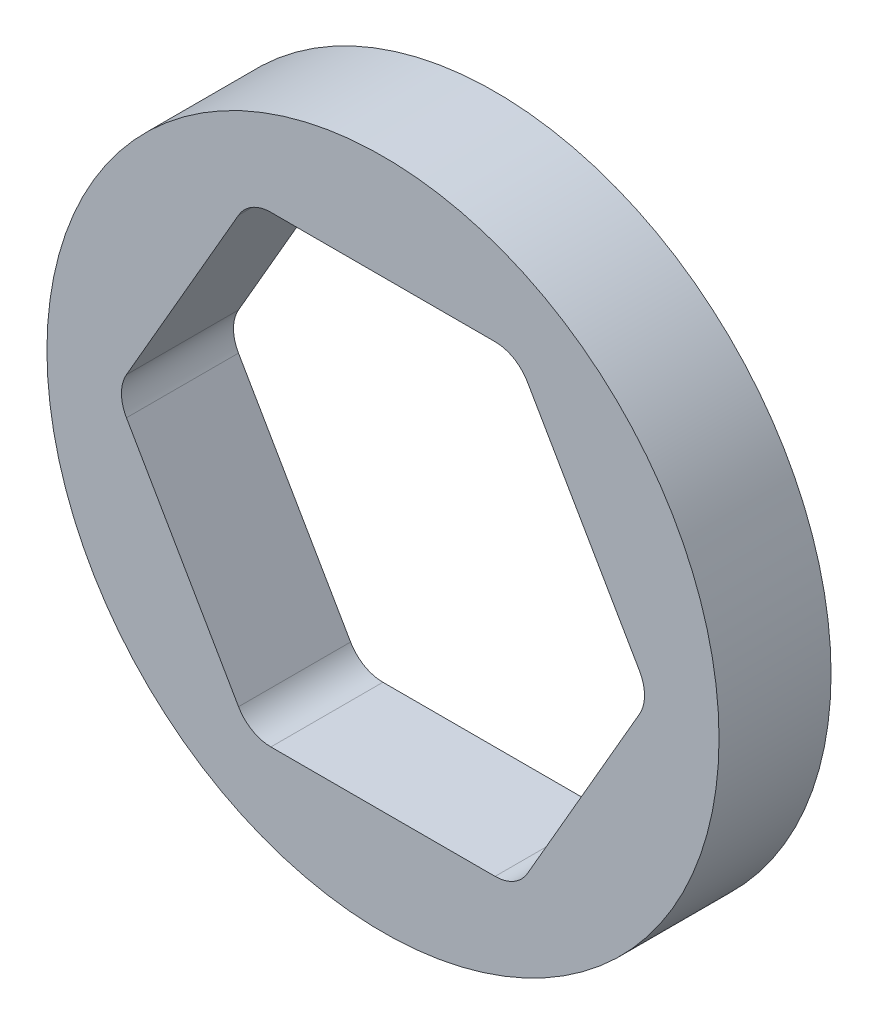
from build123d import *

# Parameters (mm, degrees)
SKETCH1_R           = 9
BOSS_EXTRUDE1_DEPTH = 3


with BuildPart() as part:
    # Sketch1 → Boss-Extrude1 (new body)
    with BuildSketch(Plane.XY.offset(3)):
        with Locations(Location((0, 0, 0), (0, 0, 180))):
            Circle(SKETCH1_R)
        with BuildLine():
            Line((-3.0022214, 6.2), (3.0022214, 6.2))
            ThreePointArc((3.0022214, 6.2), (3.5022214, 6.066025404), (3.868246804, 5.7))
            Line((3.868246804, 5.7), (6.870468203, 0.5))
            ThreePointArc((6.870468203, 0.5), (7.0044428, 0), (6.870468203, -0.5))
            Line((6.870468203, -0.5), (3.868246804, -5.7))
            ThreePointArc((3.868246804, -5.7), (3.5022214, -6.066025404), (3.0022214, -6.2))
            Line((3.0022214, -6.2), (-3.0022214, -6.2))
            ThreePointArc((-3.0022214, -6.2), (-3.5022214, -6.066025404), (-3.868246804, -5.7))
            Line((-3.868246804, -5.7), (-6.870468203, -0.5))
            ThreePointArc((-6.870468203, -0.5), (-7.0044428, 0), (-6.870468203, 0.5))
            Line((-6.870468203, 0.5), (-3.868246804, 5.7))
            ThreePointArc((-3.868246804, 5.7), (-3.5022214, 6.066025404), (-3.0022214, 6.2))
        make_face(mode=Mode.SUBTRACT)
    extrude(amount=-BOSS_EXTRUDE1_DEPTH)


solid = part.part
